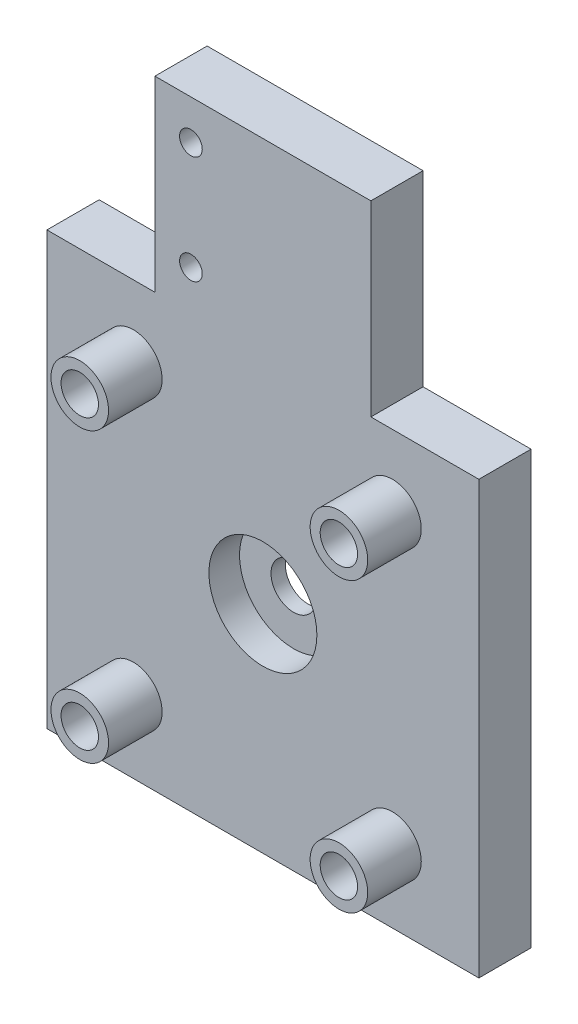
from build123d import *

# Parameters (mm, degrees)
SKETCH1_W           = 38.1
SKETCH1_H           = 76.2
BOSS_EXTRUDE1_DEPTH = 7.9375
SKETCH2_R           = 3.96875
CUT_EXTRUDE1_DEPTH  = 44.330317403
SKETCH4_R           = 9.525
CUT_EXTRUDE2_DEPTH  = 5.3975
SKETCH8_W           = 19.05
SKETCH8_H           = 76.2
BOSS_EXTRUDE5_DEPTH = 7.9375
SKETCH5_R           = 5.08
BOSS_EXTRUDE2_DEPTH = 9.4488
SKETCH6_R           = 3.302
CUT_EXTRUDE3_DEPTH  = 57.617165486
SKETCH7_W           = 38.1
SKETCH7_H           = 33.02
SKETCH7_R           = 2
BOSS_EXTRUDE4_DEPTH = 7.9375
SKETCH9_R           = 3.302
SKETCH9_R_2         = 2
SKETCH9_W           = 25.4
SKETCH9_H           = 25.4
BOSS_EXTRUDE6_DEPTH = 1.27


with BuildPart() as part:
    # Sketch1 → Boss-Extrude1 (new body)
    with BuildSketch(Plane.XY):
        Rectangle(SKETCH1_W, SKETCH1_H)
    extrude(amount=BOSS_EXTRUDE1_DEPTH)

    # Sketch2 → Cut-Extrude1 (cut, through all)
    with BuildSketch(Plane.XY.offset(7.9375)):
        Circle(SKETCH2_R)
    extrude(amount=-CUT_EXTRUDE1_DEPTH, mode=Mode.SUBTRACT)

    # Sketch4 → Cut-Extrude2 (cut)
    with BuildSketch(Plane.XY.offset(7.9375)):
        Circle(SKETCH4_R)
    extrude(amount=-CUT_EXTRUDE2_DEPTH, mode=Mode.SUBTRACT)

    # Sketch8 → Boss-Extrude5 (add)
    with BuildSketch(Plane.XY.offset(7.9375)):
        with Locations((-28.575, 0)):
            Rectangle(SKETCH8_W, SKETCH8_H)
        with Locations((28.575, 0)):
            Rectangle(SKETCH8_W, SKETCH8_H)
    extrude(amount=-BOSS_EXTRUDE5_DEPTH)

    # Sketch5 → Boss-Extrude2 (add)
    with BuildSketch(Plane.XY.offset(7.9375)):
        with Locations(Location((22.86, 25.4, 0), (0, 0, 180))):
            Circle(SKETCH5_R)
        with Locations(Location((-22.86, 25.4, 0), (0, 0, 180))):
            Circle(SKETCH5_R)
    boss_extrude2 = extrude(amount=BOSS_EXTRUDE2_DEPTH)

    # Sketch6 → Cut-Extrude3 (cut, through all)
    with BuildSketch(Plane.XY.offset(17.3863)):
        with Locations((22.86, 25.4)):
            Circle(SKETCH6_R)
        with Locations(Location((-22.86, 25.4, 0), (0, 0, 180))):
            Circle(SKETCH6_R)
    cut_extrude3 = extrude(amount=-CUT_EXTRUDE3_DEPTH, mode=Mode.SUBTRACT)

    # Mirror1: Boss-Extrude2, Cut-Extrude3 across plane
    add(boss_extrude2.mirror(Plane.ZX))
    add(cut_extrude3.mirror(Plane.ZX), mode=Mode.SUBTRACT)

    # Sketch7 → Boss-Extrude4 (add)
    with BuildSketch(Plane.XY.offset(7.9375)):
        with Locations((0, 54.61)):
            Rectangle(SKETCH7_W, SKETCH7_H)
        with Locations((-12.7, 64.135)):
            Circle(SKETCH7_R, mode=Mode.SUBTRACT)
        with Locations(Location((-12.7, 45.085, 0), (0, 0, 180))):
            Circle(SKETCH7_R, mode=Mode.SUBTRACT)
    extrude(amount=-BOSS_EXTRUDE4_DEPTH)

    # Sketch9 → Boss-Extrude6 (add)
    with BuildSketch(Plane(origin=(0, 0, 0), x_dir=(-1, 0, 0), z_dir=(0, 0, -1))):
        Polygon((-19.05, 38.1), (-38.1, 38.1), (-38.1, -38.1), (38.1, -38.1), (38.1, 38.1), (19.05, 38.1), (19.05, 71.12), (-19.05, 71.12), align=None)
        with Locations(Location((-22.86, -25.4, 0), (0, 0, 180))):
            Circle(SKETCH9_R, mode=Mode.SUBTRACT)
        with Locations((22.86, -25.4)):
            Circle(SKETCH9_R, mode=Mode.SUBTRACT)
        with Locations((22.86, 25.4)):
            Circle(SKETCH9_R, mode=Mode.SUBTRACT)
        with Locations(Location((12.7, 64.135, 0), (0, 0, 180))):
            Circle(SKETCH9_R_2, mode=Mode.SUBTRACT)
        with Locations((12.7, 45.085)):
            Circle(SKETCH9_R_2, mode=Mode.SUBTRACT)
        with Locations(Location((-22.86, 25.4, 0), (0, 0, 180))):
            Circle(SKETCH9_R, mode=Mode.SUBTRACT)
        Rectangle(SKETCH9_W, SKETCH9_H, mode=Mode.SUBTRACT)
    extrude(amount=BOSS_EXTRUDE6_DEPTH)


solid = part.part
